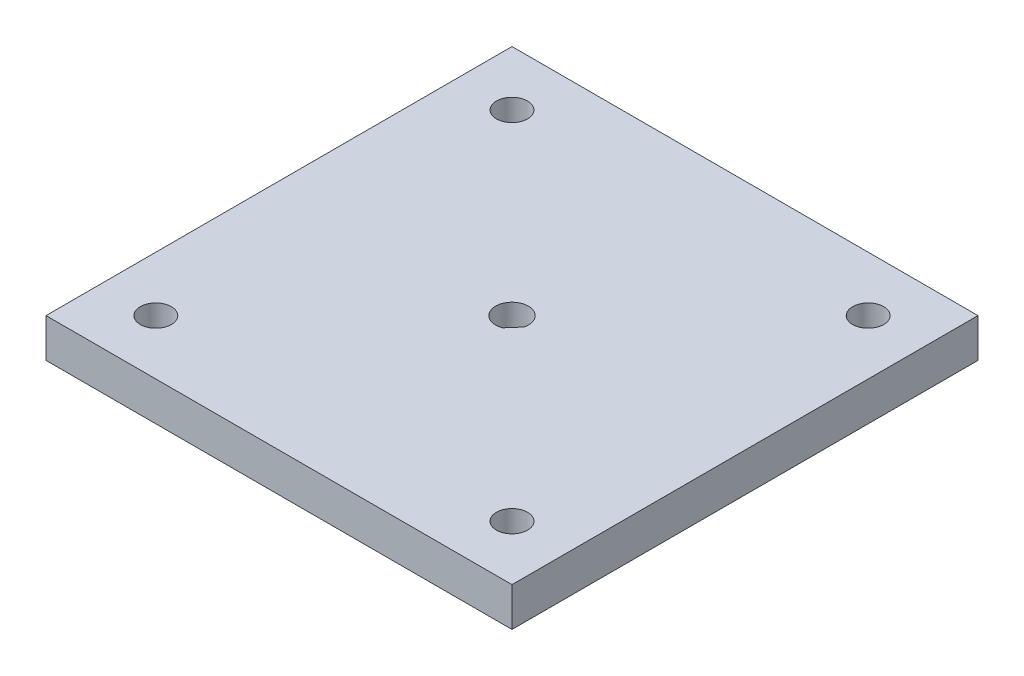
from build123d import *

# Parameters (mm, degrees)
SKETCH1_W           = 76.2
SKETCH1_H           = 76.2
SKETCH1_R           = 2.54
BOSS_EXTRUDE1_DEPTH = 6.35


with BuildPart() as part:
    # Sketch1 → Boss-Extrude1 (new body)
    with BuildSketch(Plane(origin=(0, 0, 0), x_dir=(1, 0, 0), z_dir=(0, 1, 0))):
        Rectangle(SKETCH1_W, SKETCH1_H)
        with BuildLine():
            Line((2.609105575, -0.625751054), (0.975970434, -2.4992955))
            ThreePointArc((0.975970434, -2.4992955), (-2.022556476, 1.763026259), (2.609105575, -0.625751054))
        make_face(mode=Mode.SUBTRACT)
        with Locations(Location((-29.120418144, -29.120418144, 0), (0, 0, 270))):
            Circle(SKETCH1_R, mode=Mode.SUBTRACT)
        with Locations(Location((29.120418144, 29.120418144, 0), (0, 0, 270))):
            Circle(SKETCH1_R, mode=Mode.SUBTRACT)
        with Locations(Location((29.120418144, -29.120418144, 0), (0, 0, 270))):
            Circle(SKETCH1_R, mode=Mode.SUBTRACT)
        with Locations(Location((-29.120418144, 29.120418144, 0), (0, 0, 270))):
            Circle(SKETCH1_R, mode=Mode.SUBTRACT)
    extrude(amount=BOSS_EXTRUDE1_DEPTH)


solid = part.part
